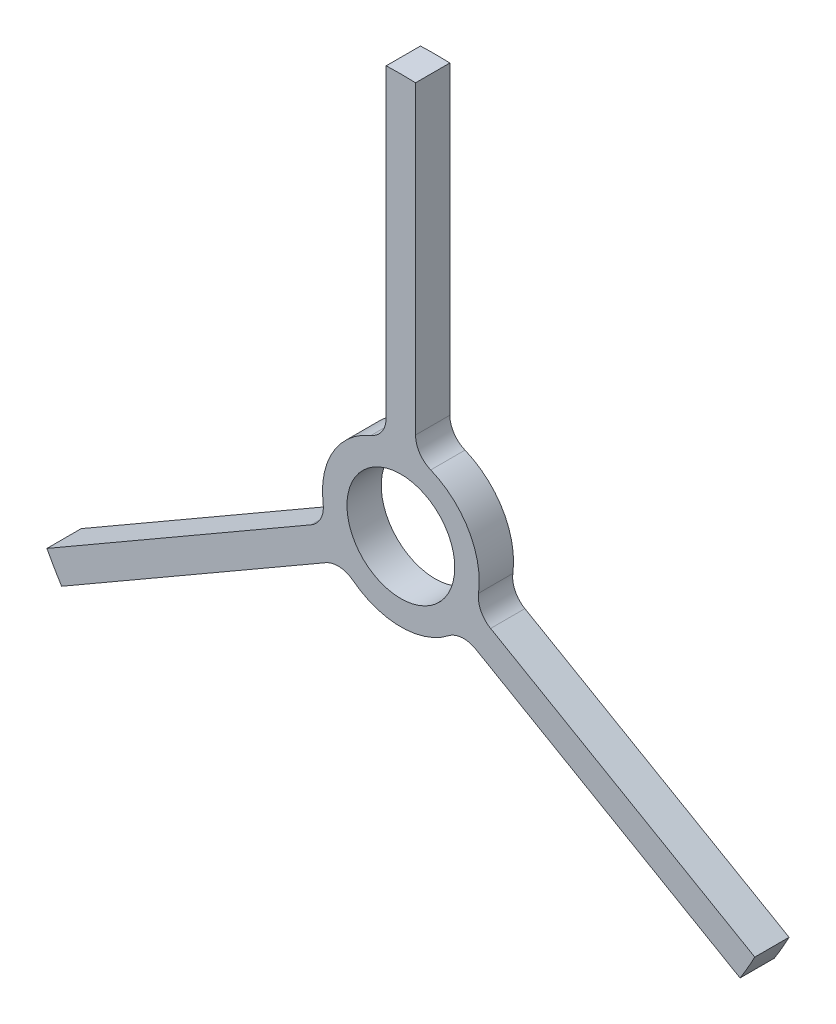
from build123d import *

# Parameters (mm, degrees)
SKETCH1_R           = 11
BOSS_EXTRUDE1_DEPTH = 7
FILLET1_R           = 5


with BuildPart() as part:
    # Sketch1 → Boss-Extrude1 (new body)
    with BuildSketch(Plane.XY):
        with BuildLine():
            Line((-3, 15.716233646), (-3, 81.669056077))
            ThreePointArc((-3, 81.669056077), (0, 81.724137931), (3, 81.669056077))
            Line((3, 81.669056077), (3, 15.716233646))
            ThreePointArc((3, 15.716233646), (13.856406461, 8), (15.110657589, -5.260040611))
            Line((15.110657589, -5.260040611), (72.227477266, -38.236451827))
            ThreePointArc((72.227477266, -38.236451827), (70.775179551, -40.862068966), (69.227477266, -43.43260425))
            Line((69.227477266, -43.43260425), (12.110657589, -10.456193034))
            ThreePointArc((12.110657589, -10.456193034), (0, -16), (-12.110657589, -10.456193034))
            Line((-12.110657589, -10.456193034), (-69.227477266, -43.43260425))
            ThreePointArc((-69.227477266, -43.43260425), (-70.775179551, -40.862068966), (-72.227477266, -38.236451827))
            Line((-72.227477266, -38.236451827), (-15.110657589, -5.260040611))
            ThreePointArc((-15.110657589, -5.260040611), (-13.856406461, 8), (-3, 15.716233646))
        make_face()
        Circle(SKETCH1_R, mode=Mode.SUBTRACT)
    extrude(amount=BOSS_EXTRUDE1_DEPTH)

    # Fillet1
    fillet1_edges = [part.edges().sort_by_distance(p)[0] for p in [
        (-3, 15.716233646, 3.5),
        (3, 15.716233646, 3.5),
        (15.110657589, -5.260040611, 3.5),
        (12.110657589, -10.456193034, 3.5),
        (-12.110657589, -10.456193034, 3.5),
        (-15.110657589, -5.260040611, 3.5),
    ]]
    fillet(fillet1_edges, radius=FILLET1_R)


solid = part.part
